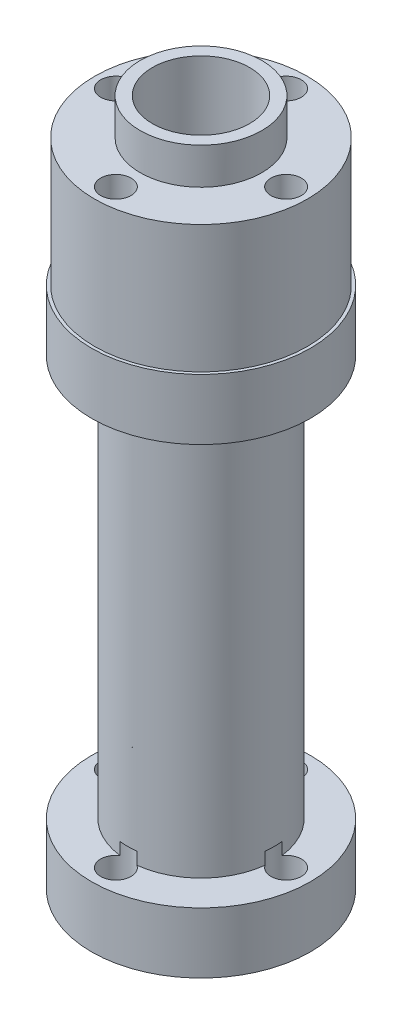
from build123d import *

# Parameters (mm, degrees)
SKETCH_2_R          = 1.25
CUT_EXTRUDE_1_DEPTH = 10
CUT_EXTRUDE_START   = -47.5
SKETCH_2_2_R        = 1.25
CUT_EXTRUDE_2_DEPTH = 6
EXTRUDE_START       = 3
SKETCH_4_R          = 5
SKETCH_4_R_2        = 4
EXTRUDE_1_DEPTH     = 3


with BuildPart() as part:
    # 草图1 → 旋转1 (revolve)
    with BuildSketch(Plane.XY, mode=Mode.PRIVATE) as revolve_1_sk:
        Polygon((-9, 38), (-6, 38), (-6, 5), (-9, 5), (-9, 0), (-4, 0), (-4, 53.5), (-8.75, 53.5), (-8.75, 43), (-9, 43), align=None)
    revolve(revolve_1_sk.sketch.rotate(Axis((0, 0, 0), (0, 1, 0)), 270), axis=Axis((0, 0, 0), (0, 1, 0)))

    # 草图2 → 切除-拉伸1 (cut)
    with BuildSketch(Plane(origin=(0, 53.5, 0), x_dir=(1, 0, 0), z_dir=(0, 1, 0))):
        with Locations(Location((0, 7, 0), (0, 0, 270))):
            Circle(SKETCH_2_R)
        with Locations(Location((7, 0, 0), (0, 0, 270))):
            Circle(SKETCH_2_R)
        with Locations(Location((0, -7, 0), (0, 0, 270))):
            Circle(SKETCH_2_R)
        with Locations(Location((-7, 0, 0), (0, 0, 270))):
            Circle(SKETCH_2_R)
    extrude(amount=-CUT_EXTRUDE_1_DEPTH, mode=Mode.SUBTRACT)

    # 草图2<2> → 切除-拉伸2 (cut)
    with BuildSketch(Plane(origin=(0, 53.5, 0), x_dir=(1, 0, 0), z_dir=(0, 1, 0)).offset(CUT_EXTRUDE_START)):
        with Locations(Location((0, 7, 0), (0, 0, 270))):
            Circle(SKETCH_2_2_R)
        with Locations(Location((7, 0, 0), (0, 0, 270))):
            Circle(SKETCH_2_2_R)
        with Locations(Location((0, -7, 0), (0, 0, 270))):
            Circle(SKETCH_2_2_R)
        with Locations(Location((-7, 0, 0), (0, 0, 270))):
            Circle(SKETCH_2_2_R)
    extrude(amount=-CUT_EXTRUDE_2_DEPTH, mode=Mode.SUBTRACT)

    # 草图4 → 凸台-拉伸1 (add)
    with BuildSketch(Plane(origin=(0, 53.5, 0), x_dir=(1, 0, 0), z_dir=(0, 1, 0)).offset(EXTRUDE_START)):
        with Locations(Location((0, 0, 0), (0, 0, 90))):
            Circle(SKETCH_4_R)
        with Locations(Location((0, 0, 0), (0, 0, 90))):
            Circle(SKETCH_4_R_2, mode=Mode.SUBTRACT)
    extrude(amount=-EXTRUDE_1_DEPTH)


solid = part.part
